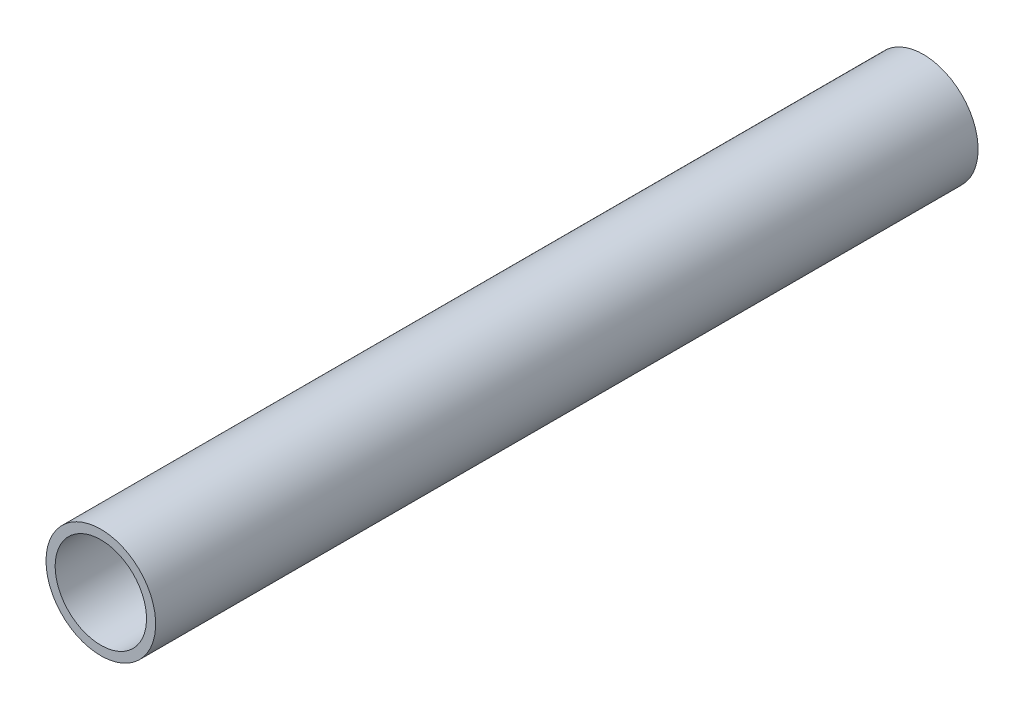
from build123d import *

# Parameters (mm, degrees)
ESQUISSE1_R        = 6
ESQUISSE1_R_2      = 5
BOSS_EXTRU_1_DEPTH = 90


with BuildPart() as part:
    # Esquisse1 → Boss.-Extru.1 (new body)
    with BuildSketch(Plane.XY):
        with Locations(Location((0, 0, 0), (0, 0, 180))):
            Circle(ESQUISSE1_R)
        with Locations(Location((0, 0, 0), (0, 0, 180))):
            Circle(ESQUISSE1_R_2, mode=Mode.SUBTRACT)
    extrude(amount=BOSS_EXTRU_1_DEPTH)


solid = part.part
